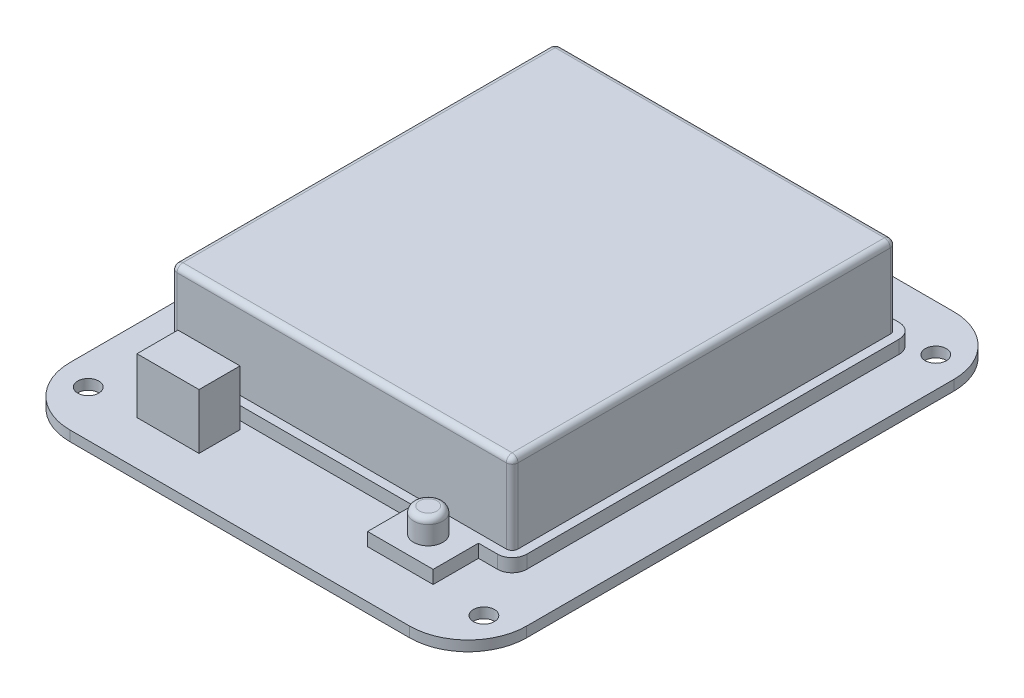
from build123d import *

# Parameters (mm, degrees)
SKETCH1_W           = 78
SKETCH1_H           = 93
BOSS_EXTRUDE1_DEPTH = 1.75
SKETCH2_R           = 1.8
CUT_EXTRUDE1_DEPTH  = 1.75
SKETCH3_W           = 58.25
SKETCH3_H           = 65.6
BOSS_EXTRUDE2_DEPTH = 16
FILLET1_R           = 1
SKETCH4_W           = 10.6
SKETCH4_H           = 7
BOSS_EXTRUDE3_DEPTH = 9.45
BOSS_EXTRUDE4_START = 2.25
BOSS_EXTRUDE4_DEPTH = 2.25
SKETCH6_W           = 11.2
SKETCH6_H           = 7.75
BOSS_EXTRUDE5_DEPTH = 2.25
SKETCH7_W           = 51.25
SKETCH7_H           = 58.6
CUT_EXTRUDE2_DEPTH  = 13.75
SKETCH8_R           = 2.5
BOSS_EXTRUDE6_DEPTH = 4.15
FILLET2_R           = 1


with BuildPart() as part:
    # Sketch1 → Boss-Extrude1 (new body)
    with BuildSketch(Plane(origin=(0, 0, 0), x_dir=(1, 0, 0), z_dir=(0, 1, 0))):
        Rectangle(SKETCH1_W, SKETCH1_H)
    extrude(amount=BOSS_EXTRUDE1_DEPTH)

    # Sketch2 → Cut-Extrude1 (cut)
    with BuildSketch(Plane(origin=(0, 1.75, 0), x_dir=(1, 0, 0), z_dir=(0, 1, 0))):
        with Locations(Location((-33.8, 38.6, 0), (0, 0, 270))):
            Circle(SKETCH2_R)
        with Locations(Location((33.8, 38.6, 0), (0, 0, 270))):
            Circle(SKETCH2_R)
        with Locations(Location((33.8, -38.6, 0), (0, 0, 270))):
            Circle(SKETCH2_R)
        with Locations(Location((-33.8, -38.6, 0), (0, 0, 270))):
            Circle(SKETCH2_R)
        with BuildLine():
            Line((-39, 36.5), (-39, 46.5))
            Line((-39, 46.5), (-29, 46.5))
            ThreePointArc((-29, 46.5), (-36.071067812, 43.571067812), (-39, 36.5))
        make_face()
        with BuildLine():
            Line((39, 36.5), (39, 46.5))
            Line((39, 46.5), (29, 46.5))
            ThreePointArc((29, 46.5), (36.071067812, 43.571067812), (39, 36.5))
        make_face()
        with BuildLine():
            Line((39, -36.5), (39, -46.5))
            Line((39, -46.5), (29, -46.5))
            ThreePointArc((29, -46.5), (36.071067812, -43.571067812), (39, -36.5))
        make_face()
        with BuildLine():
            Line((-39, -36.5), (-39, -46.5))
            Line((-39, -46.5), (-29, -46.5))
            ThreePointArc((-29, -46.5), (-36.071067812, -43.571067812), (-39, -36.5))
        make_face()
    extrude(amount=-CUT_EXTRUDE1_DEPTH, mode=Mode.SUBTRACT)

    # Sketch3 → Boss-Extrude2 (add)
    with BuildSketch(Plane(origin=(0, 1.75, 0), x_dir=(1, 0, 0), z_dir=(0, 1, 0))):
        with Locations((0, 3.7)):
            Rectangle(SKETCH3_W, SKETCH3_H)
    extrude(amount=BOSS_EXTRUDE2_DEPTH)

    # Fillet1
    fillet1_edges = [part.edges().sort_by_distance(p)[0] for p in [
        (0, 17.75, -36.5),
        (29.125, 9.75, -36.5),
        (29.125, 17.75, -3.7),
        (29.125, 9.75, 29.1),
        (0, 17.75, 29.1),
        (-29.125, 9.75, 29.1),
        (-29.125, 17.75, -3.7),
        (-29.125, 9.75, -36.5),
    ]]
    fillet(fillet1_edges, radius=FILLET1_R)

    # Sketch4 → Boss-Extrude3 (add)
    with BuildSketch(Plane(origin=(0, 1.75, 0), x_dir=(1, 0, 0), z_dir=(0, 1, 0))):
        with Locations((-19.825, -35.45)):
            Rectangle(SKETCH4_W, SKETCH4_H)
    extrude(amount=BOSS_EXTRUDE3_DEPTH)

    # Sketch5 → Boss-Extrude4 (add)
    with BuildSketch(Plane(origin=(0, 1.75, 0), x_dir=(1, 0, 0), z_dir=(0, 1, 0)).offset(BOSS_EXTRUDE4_START)):
        with BuildLine():
            Line((-28.125, -30.6), (28.125, -30.6))
            ThreePointArc((28.125, -30.6), (29.892766953, -29.867766953), (30.625, -28.1))
            Line((30.625, -28.1), (30.625, 35.5))
            ThreePointArc((30.625, 35.5), (29.892766953, 37.267766953), (28.125, 38))
            Line((28.125, 38), (-28.125, 38))
            ThreePointArc((-28.125, 38), (-29.892766953, 37.267766953), (-30.625, 35.5))
            Line((-30.625, 35.5), (-30.625, -28.1))
            ThreePointArc((-30.625, -28.1), (-29.892766953, -29.867766953), (-28.125, -30.6))
        make_face()
        with BuildLine():
            ThreePointArc((-29.125, 35.5), (-28.832106781, 36.207106781), (-28.125, 36.5))
            Line((-28.125, 36.5), (28.125, 36.5))
            ThreePointArc((28.125, 36.5), (28.832106781, 36.207106781), (29.125, 35.5))
            Line((29.125, 35.5), (29.125, -28.1))
            ThreePointArc((29.125, -28.1), (28.832106781, -28.807106781), (28.125, -29.1))
            Line((28.125, -29.1), (-28.125, -29.1))
            ThreePointArc((-28.125, -29.1), (-28.832106781, -28.807106781), (-29.125, -28.1))
            Line((-29.125, -28.1), (-29.125, 35.5))
        make_face(mode=Mode.SUBTRACT)
    extrude(amount=-BOSS_EXTRUDE4_DEPTH)

    # Sketch6 → Boss-Extrude5 (add)
    with BuildSketch(Plane(origin=(0, 1.75, 0), x_dir=(1, 0, 0), z_dir=(0, 1, 0))):
        with Locations((19.275, -34.475)):
            Rectangle(SKETCH6_W, SKETCH6_H)
    extrude(amount=BOSS_EXTRUDE5_DEPTH)

    # Sketch7 → Cut-Extrude2 (cut)
    with BuildSketch(Plane.XZ):
        with Locations((0, -3.7)):
            Rectangle(SKETCH7_W, SKETCH7_H)
    extrude(amount=-CUT_EXTRUDE2_DEPTH, mode=Mode.SUBTRACT)

    # Sketch8 → Boss-Extrude6 (add)
    with BuildSketch(Plane(origin=(0, 4, 0), x_dir=(1, 0, 0), z_dir=(0, 1, 0))):
        with Locations(Location((19.222552854, -33.536468805, 0), (0, 0, 90))):
            Circle(SKETCH8_R)
    extrude(amount=BOSS_EXTRUDE6_DEPTH)

    # Fillet2
    fillet2_edges = [part.edges().sort_by_distance(p)[0] for p in [
        (19.222552854, 8.15, 36.036468805),
    ]]
    fillet(fillet2_edges, radius=FILLET2_R)


solid = part.part
